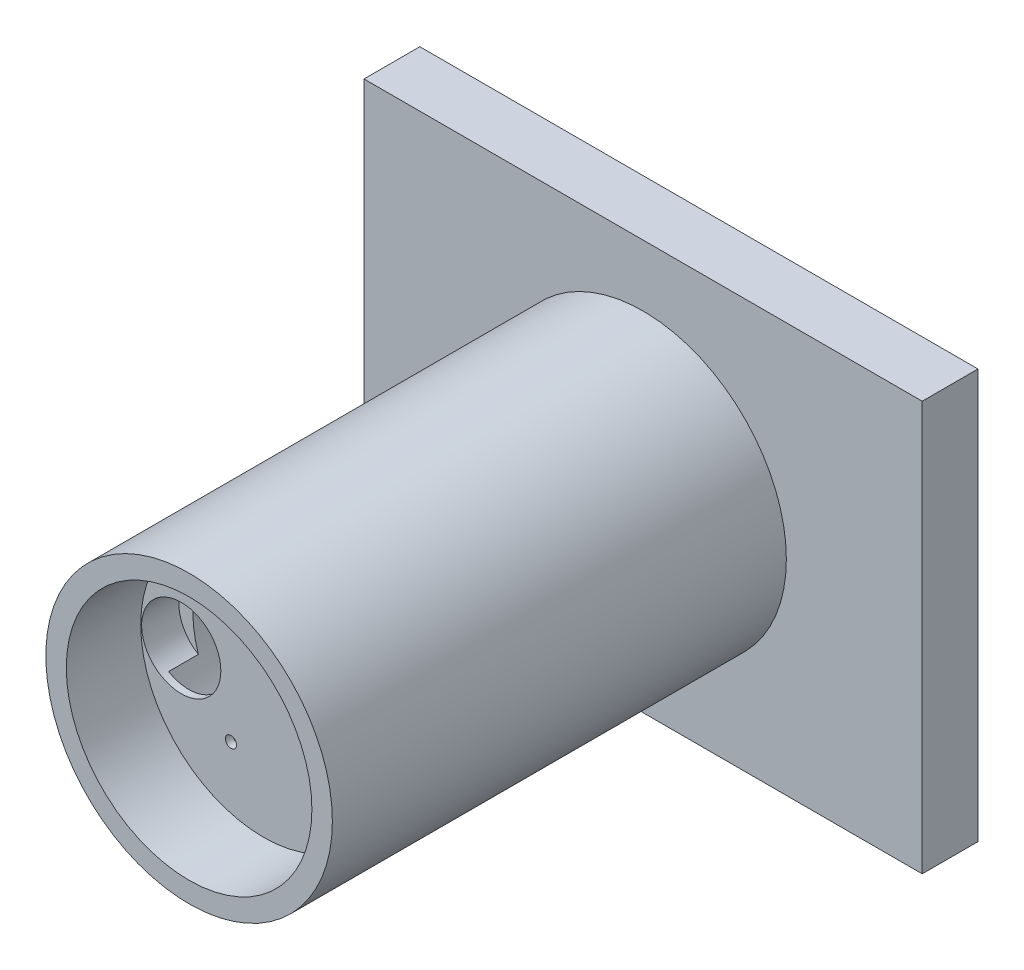
from build123d import *

# Parameters (mm, degrees)
SKETCH_1_W          = 150
SKETCH_1_H          = 110
EXTRUDE_1_DEPTH     = 15
SKETCH_2_R          = 38.5
EXTRUDE_2_DEPTH     = 100
SKETCH_4_R          = 29
CUT_EXTRUDE_1_DEPTH = 145
SKETCH_5_R          = 33
EXTRUDE_3_DEPTH     = 2
SKETCH_6_R          = 1.5
CUT_EXTRUDE_2_DEPTH = 2
SKETCH_7_R          = 38.5
SKETCH_7_R_2        = 33
EXTRUDE_4_DEPTH     = 22
SKETCH_8_R          = 10.643046967
CUT_EXTRUDE_3_DEPTH = 10


with BuildPart() as part:
    # 草图1 → 凸台-拉伸1 (new body)
    with BuildSketch(Plane.XY):
        Rectangle(SKETCH_1_W, SKETCH_1_H)
    extrude(amount=EXTRUDE_1_DEPTH)

    # 草图2 → 凸台-拉伸2 (add)
    with BuildSketch(Plane.XY.offset(15)):
        Circle(SKETCH_2_R)
    extrude(amount=EXTRUDE_2_DEPTH)

    # 草图4 → 切除-拉伸1 (cut)
    with BuildSketch(Plane.XY.offset(115)):
        Circle(SKETCH_4_R)
    extrude(amount=-CUT_EXTRUDE_1_DEPTH, mode=Mode.SUBTRACT)

    # 草图5 → 凸台-拉伸3 (add)
    with BuildSketch(Plane.XY.offset(115)):
        Circle(SKETCH_5_R)
    extrude(amount=EXTRUDE_3_DEPTH)

    # 草图6 → 切除-拉伸2 (cut)
    with BuildSketch(Plane.XY.offset(117)):
        with Locations((17.5, 0)):
            Circle(SKETCH_6_R)
        with Locations((-8.75, -15.155444566)):
            Circle(SKETCH_6_R)
        with Locations((-8.75, 15.155444566)):
            Circle(SKETCH_6_R)
    extrude(amount=-CUT_EXTRUDE_2_DEPTH, mode=Mode.SUBTRACT)

    # 草图7 → 凸台-拉伸4 (add)
    with BuildSketch(Plane.XY.offset(115)):
        Circle(SKETCH_7_R)
        Circle(SKETCH_7_R_2, mode=Mode.SUBTRACT)
    extrude(amount=EXTRUDE_4_DEPTH)

    # 草图8 → 切除-拉伸3 (cut)
    with BuildSketch(Plane.XY.offset(117)):
        with Locations((-22.11085185, 0)):
            Circle(SKETCH_8_R)
    extrude(amount=-CUT_EXTRUDE_3_DEPTH, mode=Mode.SUBTRACT)


solid = part.part
